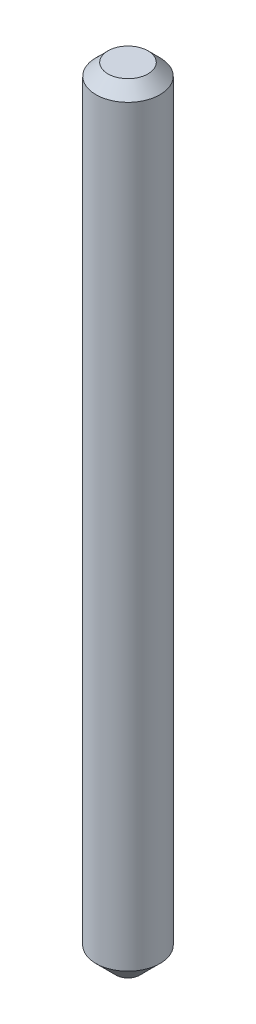
from build123d import *

# Parameters (mm, degrees)
SKETCH1_R           = 4
BOSS_EXTRUDE1_DEPTH = 98
CHAMFER1_SIZE       = 2.5
CHAMFER2_SIZE       = 1.5


with BuildPart() as part:
    # Sketch1 → Boss-Extrude1 (new body)
    with BuildSketch(Plane(origin=(0, 0, 0), x_dir=(1, 0, 0), z_dir=(0, 1, 0))):
        with Locations(Location((0, 0, 0), (0, 0, 270))):
            Circle(SKETCH1_R)
    extrude(amount=BOSS_EXTRUDE1_DEPTH)

    # Chamfer1
    chamfer1_edges = [part.edges().sort_by_distance(p)[0] for p in [
        (0, 0, -4),
    ]]
    chamfer(chamfer1_edges, length=CHAMFER1_SIZE)

    # Chamfer2
    chamfer2_edges = [part.edges().sort_by_distance(p)[0] for p in [
        (0, 98, -4),
    ]]
    chamfer(chamfer2_edges, length=CHAMFER2_SIZE)


solid = part.part
